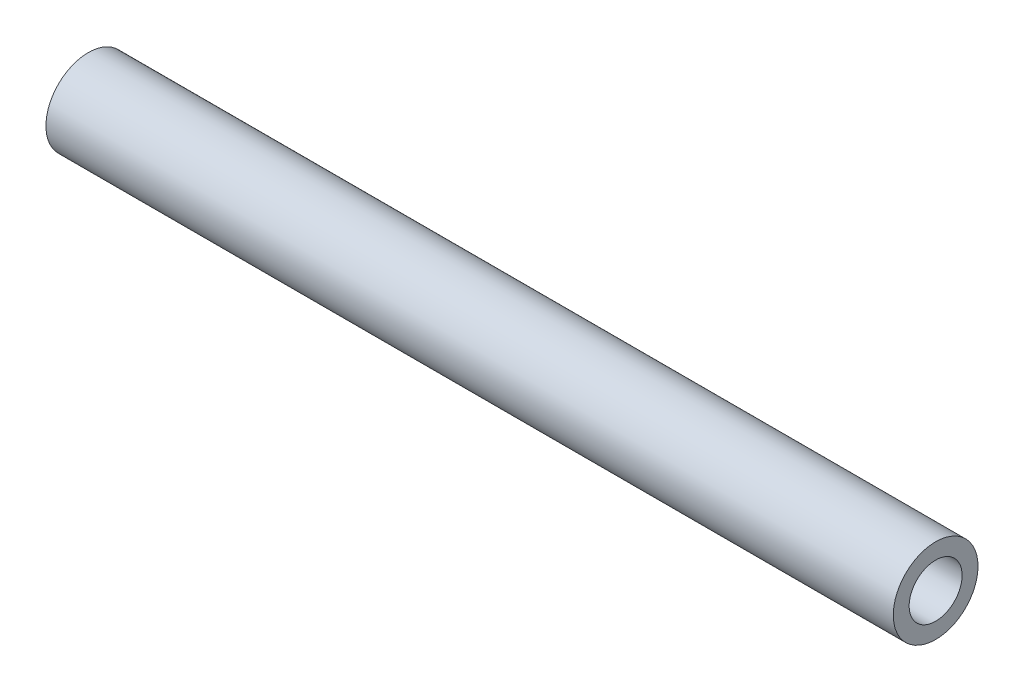
from build123d import *

# Parameters (mm, degrees)
SKETCH1_R      = 6.35
SKETCH1_R_2    = 3.96875
EXTRUDE1_DEPTH = 127


with BuildPart() as part:
    # Sketch1 → Extrude1 (new body)
    with BuildSketch(Plane(origin=(0, 0, 0), x_dir=(0, 0, -1), z_dir=(1, 0, 0))):
        Circle(SKETCH1_R)
        Circle(SKETCH1_R_2, mode=Mode.SUBTRACT)
    extrude(amount=EXTRUDE1_DEPTH)


solid = part.part
